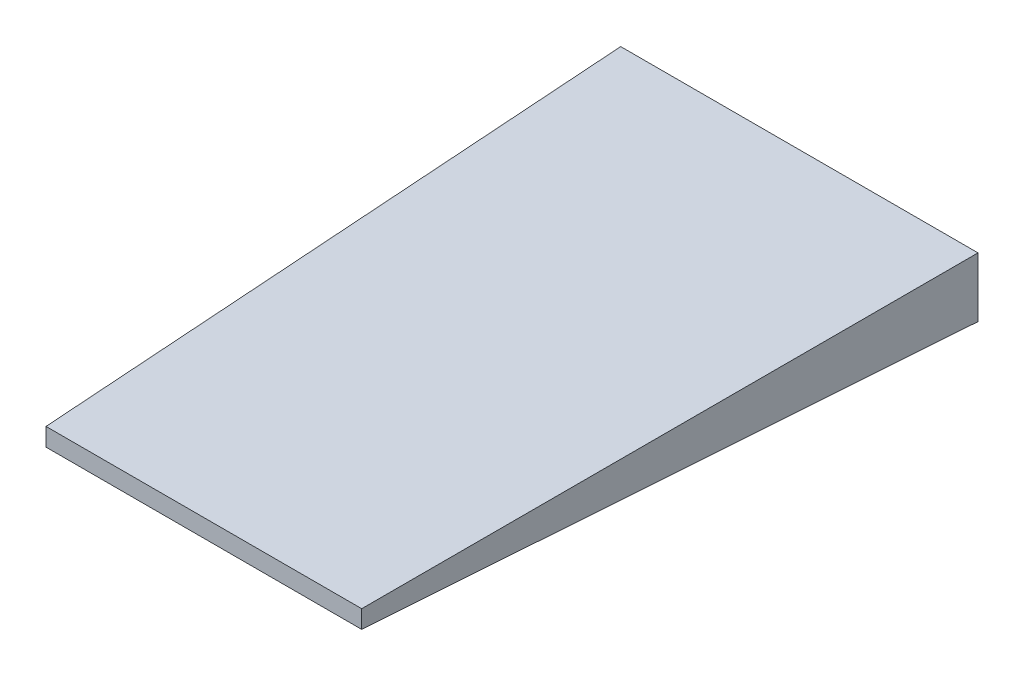
from build123d import *

# Parameters (mm, degrees)
SKETCH1_W           = 152.4
SKETCH1_H           = 25.4
BOSS_EXTRUDE1_DEPTH = 254
BOSS_EXTRUDE1_TAPER = 2


with BuildPart() as part:
    # Sketch1 → Boss-Extrude1 (new body)
    with BuildSketch(Plane.XY):
        Rectangle(SKETCH1_W, SKETCH1_H)
    extrude(amount=BOSS_EXTRUDE1_DEPTH, taper=BOSS_EXTRUDE1_TAPER)


solid = part.part
